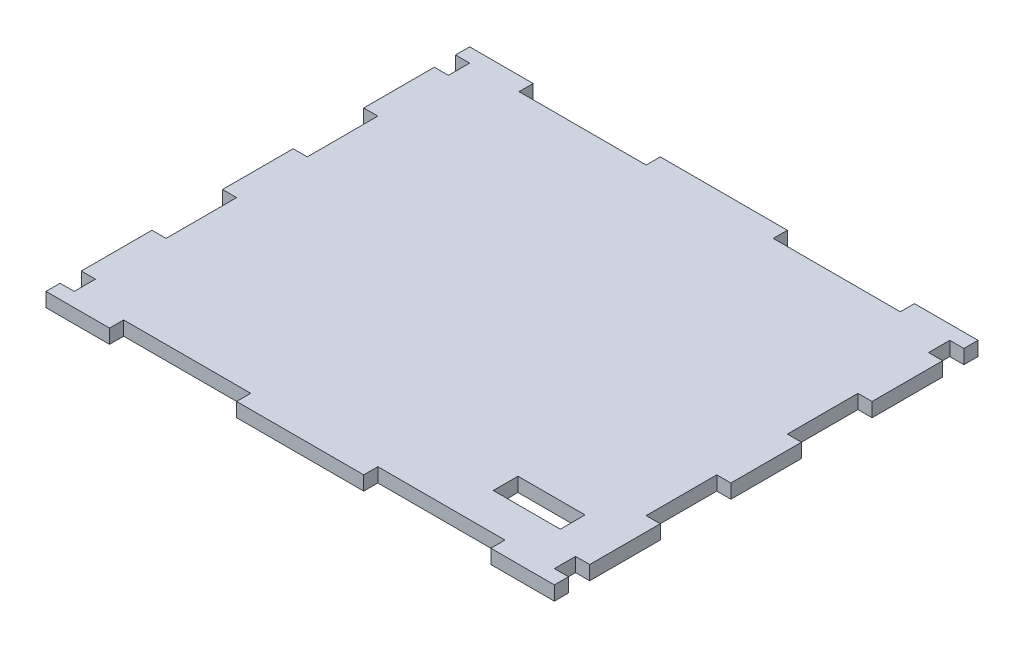
from build123d import *

# Parameters (mm, degrees)
BOSS_EXTRUDE2_DEPTH = 6.35
SKETCH3_W           = 30.1625
SKETCH3_H           = 11.1125
CUT_EXTRUDE1_DEPTH  = 6.35


with BuildPart() as part:
    # Sketch1 → Boss-Extrude2 (new body)
    with BuildSketch(Plane(origin=(0, 0, 0), x_dir=(1, 0, 0), z_dir=(0, 1, 0))):
        Polygon((114.3, 95.25), (85.725, 95.25), (85.725, 88.9), (28.575, 88.9), (28.575, 95.25), (-28.575, 95.25), (-28.575, 88.9), (-85.725, 88.9), (-85.725, 95.25), (-114.3, 95.25), (-114.3, 88.9), (-107.95, 88.9), (-107.95, 79.375), (-114.3, 79.375), (-114.3, 47.625), (-107.95, 47.625), (-107.95, 15.875), (-114.3, 15.875), (-114.3, -15.875), (-107.95, -15.875), (-107.95, -47.625), (-114.3, -47.625), (-114.3, -79.375), (-107.95, -79.375), (-107.95, -88.9), (-114.3, -88.9), (-114.3, -95.25), (-85.725, -95.25), (-85.725, -88.9), (-28.575, -88.9), (-28.575, -95.25), (28.575, -95.25), (28.575, -88.9), (85.725, -88.9), (85.725, -95.25), (114.3, -95.25), (114.3, -88.9), (107.95, -88.9), (107.95, -79.375), (114.3, -79.375), (114.3, -47.625), (107.95, -47.625), (107.95, -15.875), (114.3, -15.875), (114.3, 15.875), (107.95, 15.875), (107.95, 47.625), (114.3, 47.625), (114.3, 79.375), (107.95, 79.375), (107.95, 88.9), (114.3, 88.9), align=None)
    extrude(amount=BOSS_EXTRUDE2_DEPTH)

    # Sketch3 → Cut-Extrude1 (cut)
    with BuildSketch(Plane(origin=(0, 6.35, 0), x_dir=(1, 0, 0), z_dir=(0, 1, 0))):
        with Locations((78.868959442, -66.665058112)):
            Rectangle(SKETCH3_W, SKETCH3_H)
    extrude(amount=-CUT_EXTRUDE1_DEPTH, mode=Mode.SUBTRACT)


solid = part.part
